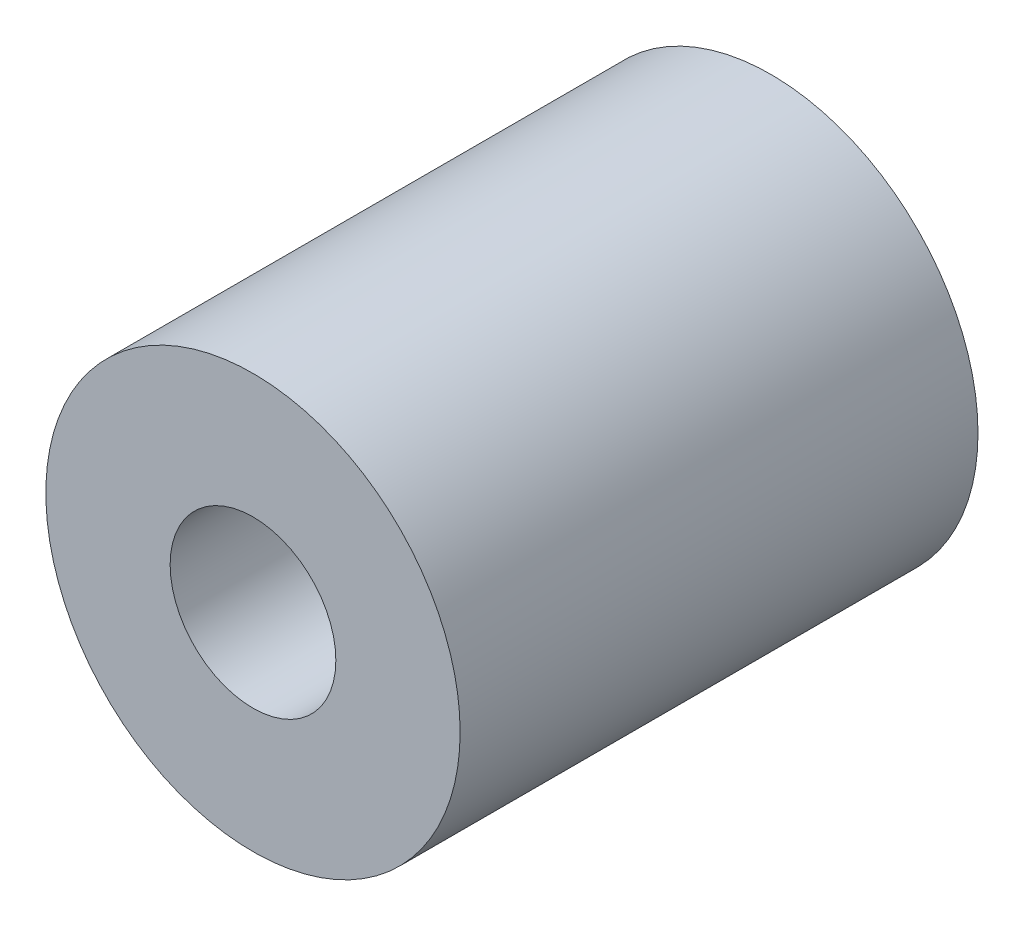
from build123d import *

# Parameters (mm, degrees)
SKETCH_1_R      = 10
SKETCH_1_R_2    = 2
EXTRUDE_1_DEPTH = 12.5
SKETCH_2_R      = 10
SKETCH_2_R_2    = 4
EXTRUDE_2_DEPTH = 12.5


with BuildPart() as part:
    # 草图1 → 凸台-拉伸1 (new body)
    with BuildSketch(Plane.XY):
        Circle(SKETCH_1_R)
        Circle(SKETCH_1_R_2, mode=Mode.SUBTRACT)
    extrude(amount=EXTRUDE_1_DEPTH)

    # 草图2 → 凸台-拉伸2 (add)
    with BuildSketch(Plane.XY.offset(12.5)):
        Circle(SKETCH_2_R)
        Circle(SKETCH_2_R_2, mode=Mode.SUBTRACT)
    extrude(amount=EXTRUDE_2_DEPTH)


solid = part.part
